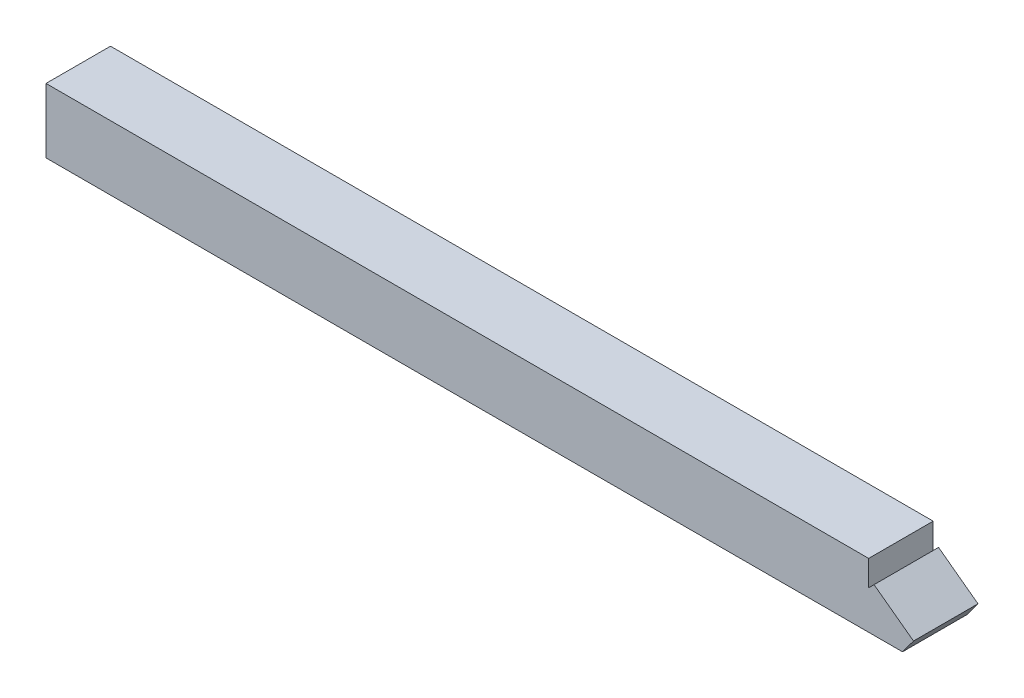
from build123d import *

# Parameters (mm, degrees)
BOSS_EXTRUDE1_DEPTH = 2.5
SKETCH3_R           = 1
CUT_EXTRUDE1_DEPTH  = 9.5
SKETCH4_W           = 2.5
SKETCH4_H           = 2.5
BOSS_EXTRUDE3_DEPTH = 17
SKETCH5_R           = 1
CUT_EXTRUDE2_DEPTH  = 9.5


with BuildPart() as part:
    # Sketch1 → Boss-Extrude1 (new body)
    with BuildSketch(Plane.XY):
        Polygon((0, 0), (0, 1.5), (0, 2.5), (14.886845494, 2.5), (14.886845494, 1.514116192), (15.095983031, 1.72325373), (16.624293577, 0.594484955), (16.2, 0.02000738), align=None)
    extrude(amount=BOSS_EXTRUDE1_DEPTH)

    # Sketch3 → Cut-Extrude1 (cut)
    with BuildSketch(Plane.ZY):
        with Locations(Location((1.25, 1.25, 0), (0, 0, 270))):
            Circle(SKETCH3_R)
    extrude(amount=-CUT_EXTRUDE1_DEPTH, mode=Mode.SUBTRACT)

    # Sketch4 → Boss-Extrude3 (add)
    with BuildSketch(Plane.ZY):
        with Locations((1.25, 1.25)):
            Rectangle(SKETCH4_W, SKETCH4_H)
    extrude(amount=BOSS_EXTRUDE3_DEPTH)

    # Sketch5 → Cut-Extrude2 (cut)
    with BuildSketch(Plane.ZY.offset(17)):
        with Locations(Location((1.25, 1.25, 0), (0, 0, 270))):
            Circle(SKETCH5_R)
    extrude(amount=-CUT_EXTRUDE2_DEPTH, mode=Mode.SUBTRACT)


solid = part.part
